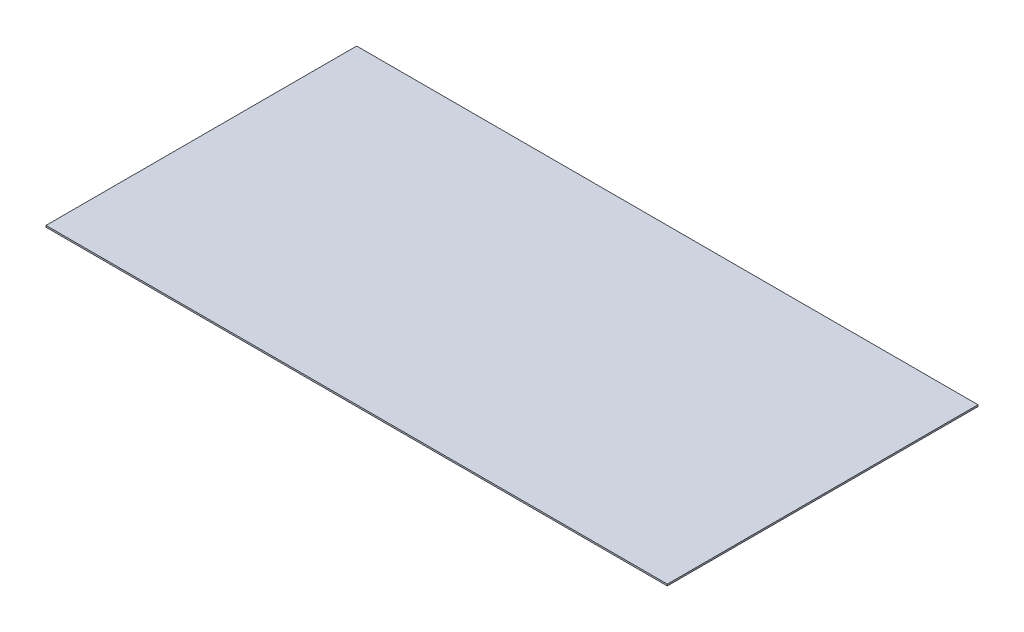
from build123d import *

# Parameters (mm, degrees)
SKETCH1_W           = 1219.2
SKETCH1_H           = 609.6
BOSS_EXTRUDE1_DEPTH = 3.175


with BuildPart() as part:
    # Sketch1 → Boss-Extrude1 (new body)
    with BuildSketch(Plane(origin=(0, 0, 0), x_dir=(1, 0, 0), z_dir=(0, 1, 0))):
        Rectangle(SKETCH1_W, SKETCH1_H)
    extrude(amount=BOSS_EXTRUDE1_DEPTH)


solid = part.part
